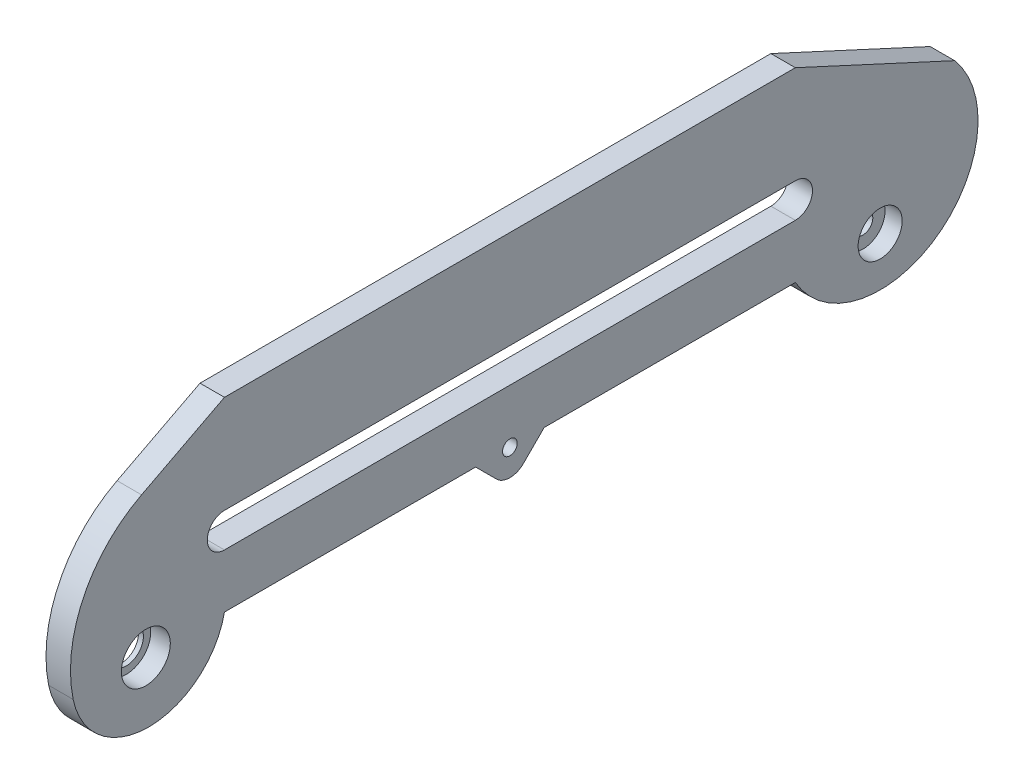
from build123d import *

# Parameters (mm, degrees)
SKETCH2_R           = 5
SKETCH2_R_2         = 2
SKETCH2_R_3         = 1.5
BOSS_EXTRUDE1_DEPTH = 5
SKETCH3_R           = 4.5
CUT_EXTRUDE1_DEPTH  = 3.5
BOSS_EXTRUDE2_START = -5
SKETCH4_R           = 5
SKETCH4_R_2         = 3.5
BOSS_EXTRUDE2_DEPTH = 1


with BuildPart() as part:
    # Sketch2 → Boss-Extrude1 (new body)
    with BuildSketch(Plane(origin=(0, 0, 0), x_dir=(0, 0, -1), z_dir=(1, 0, 0))):
        with BuildLine():
            Line((58.308676511, 0), (-58.308676511, 0))
            Line((-58.308676511, 0), (-75.243665272, -8.783179062))
            ThreePointArc((-75.243665272, -8.783179062), (-87.141316573, -21.040619401), (-89.217284989, -37.996128985))
            ThreePointArc((-89.217284989, -37.996128985), (-73.76298075, -50.59971931), (-58.308676511, -37.996128985))
            Line((-58.308676511, -37.996128985), (-7, -37.996128985))
            Line((-7, -37.996128985), (-2.757359313, -42.238769672))
            ThreePointArc((-2.757359313, -42.238769672), (0, -43.380905296), (2.757359313, -42.238769672))
            Line((2.757359313, -42.238769672), (7, -37.996128985))
            Line((7, -37.996128985), (58.308676511, -37.996128985))
            ThreePointArc((58.308676511, -37.996128985), (87.163327852, -44.335147902), (90.85122644, -15.023486932))
            Line((90.85122644, -15.023486932), (58.308676511, 0))
        make_face()
        with Locations((-74.370815413, -37.996128985)):
            Circle(SKETCH2_R, mode=Mode.SUBTRACT)
        with Locations((75.629184587, -37.996128985)):
            Circle(SKETCH2_R_2, mode=Mode.SUBTRACT)
        with Locations((0, -38)):
            Circle(SKETCH2_R_3, mode=Mode.SUBTRACT)
        with BuildLine():
            Line((-58.308676511, -27), (58.308676511, -27))
            ThreePointArc((58.308676511, -27), (61.808676511, -23.5), (58.308676511, -20))
            Line((58.308676511, -20), (-58.308676511, -20))
            ThreePointArc((-58.308676511, -20), (-61.808676511, -23.5), (-58.308676511, -27))
        make_face(mode=Mode.SUBTRACT)
    extrude(amount=BOSS_EXTRUDE1_DEPTH)

    # Sketch3 → Cut-Extrude1 (cut)
    with BuildSketch(Plane(origin=(5, 0, 0), x_dir=(0, 0, -1), z_dir=(1, 0, 0))):
        with Locations((75.629184587, -37.996128985)):
            Circle(SKETCH3_R)
    extrude(amount=-CUT_EXTRUDE1_DEPTH, mode=Mode.SUBTRACT)

    # Sketch4 → Boss-Extrude2 (add)
    with BuildSketch(Plane(origin=(5, 0, 0), x_dir=(0, 0, -1), z_dir=(1, 0, 0)).offset(BOSS_EXTRUDE2_START)):
        with Locations((-74.370815413, -37.996128985)):
            Circle(SKETCH4_R)
        with Locations((-74.370815413, -37.996128985)):
            Circle(SKETCH4_R_2, mode=Mode.SUBTRACT)
    extrude(amount=BOSS_EXTRUDE2_DEPTH)


solid = part.part
